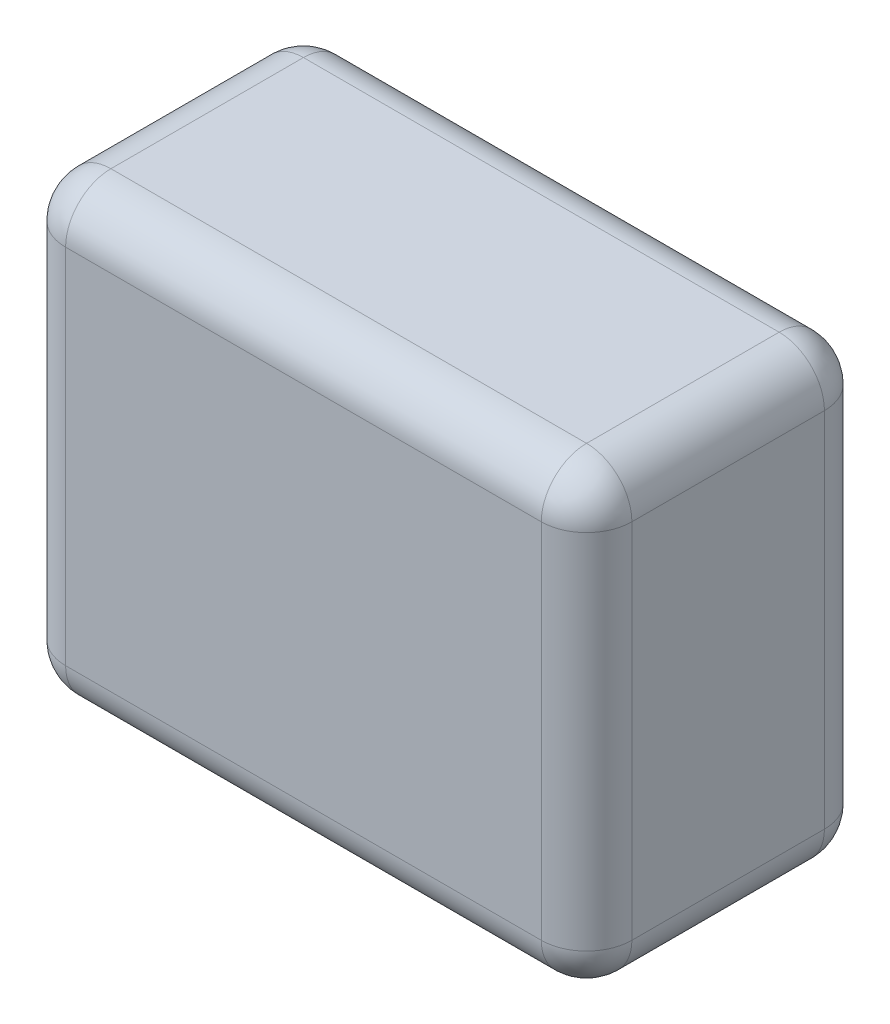
from build123d import *

# Parameters (mm, degrees)
SKETCH1_W           = 50
SKETCH1_H           = 40
BOSS_EXTRUDE1_DEPTH = 25
FILLET1_R           = 4


with BuildPart() as part:
    # Sketch1 → Boss-Extrude1 (new body)
    with BuildSketch(Plane.XY):
        Rectangle(SKETCH1_W, SKETCH1_H)
    extrude(amount=BOSS_EXTRUDE1_DEPTH)

    # Fillet1
    fillet1_edges = [part.edges().sort_by_distance(p)[0] for p in [
        (-25, 0, 25),
        (0, -20, 25),
        (25, 0, 25),
        (0, -20, 0),
        (-25, 0, 0),
        (0, 20, 0),
        (25, 0, 0),
        (25, -20, 12.5),
        (-25, -20, 12.5),
        (-25, 20, 12.5),
        (25, 20, 12.5),
        (0, 20, 25),
    ]]
    fillet(fillet1_edges, radius=FILLET1_R)


solid = part.part
